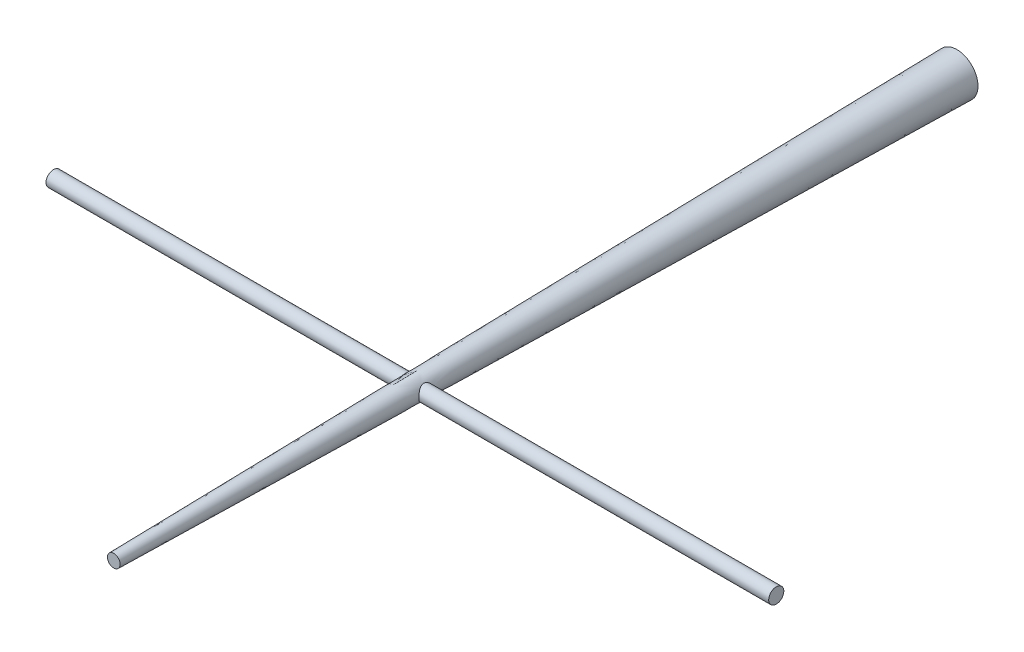
from build123d import *

# Parameters (mm, degrees)
SKETCH1_R                = 175
BOSS_EXTRUDE1_DEPTH      = 7000
BOSS_EXTRUDE1_TAPER      = 1
BOSS_EXTRUDE2_DEPTH      = 3000
BOSS_EXTRUDE2_DEPTH_BACK = 3000
SKETCH2_R                = 62.746836561


with BuildPart() as part:
    # Sketch1 → Boss-Extrude1 (new body)
    with BuildSketch(Plane.XY):
        Circle(SKETCH1_R)
    extrude(amount=BOSS_EXTRUDE1_DEPTH, taper=BOSS_EXTRUDE1_TAPER)

    # Sketch2 → Boss-Extrude2 (add, two sides: drawn at the far end of the back side and taken through both)
    with BuildSketch(Plane(origin=(0, 0, 0), x_dir=(0, 0, -1), z_dir=(1, 0, 0)).offset(-BOSS_EXTRUDE2_DEPTH_BACK)):
        with Locations((-4500, 0)):
            Circle(SKETCH2_R)
    extrude(amount=BOSS_EXTRUDE2_DEPTH + BOSS_EXTRUDE2_DEPTH_BACK)


solid = part.part
